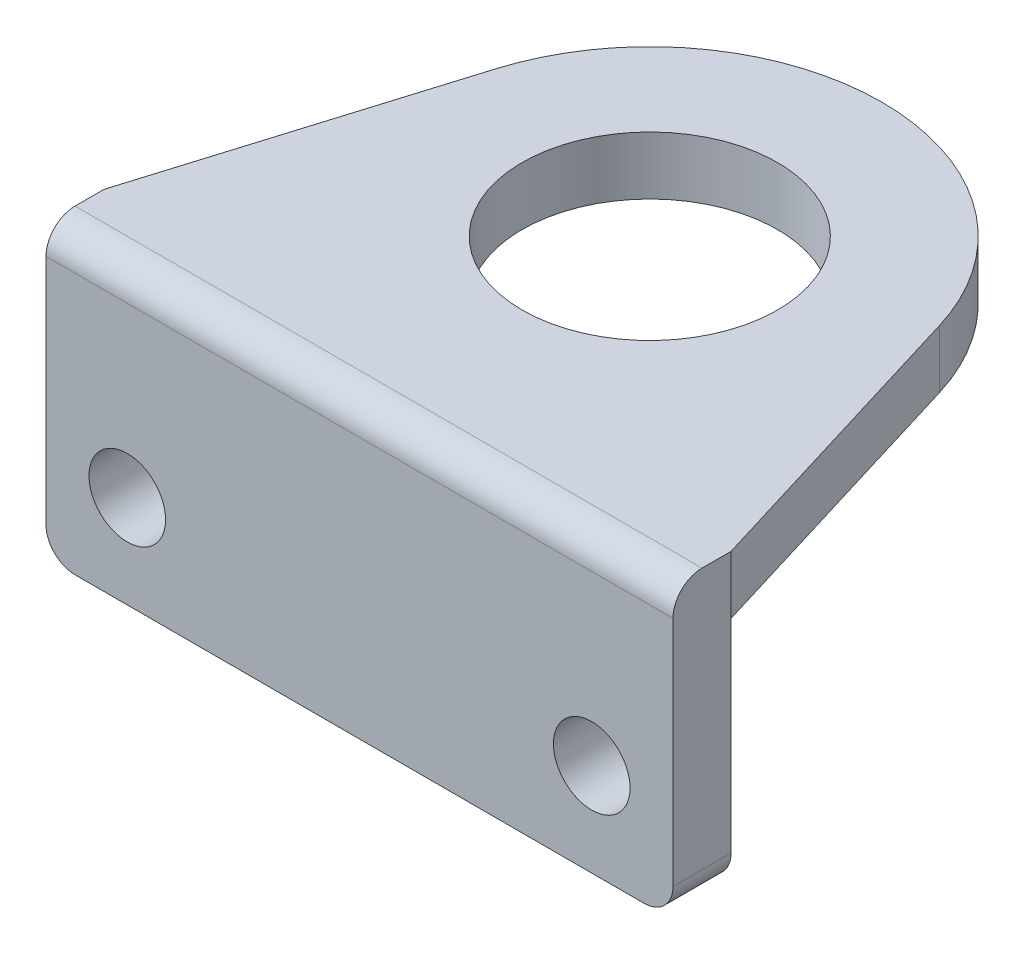
from build123d import *

# Parameters (mm, degrees)
CROQUIS1_R              = 11
SALIENTE_EXTRUIR1_DEPTH = 5
CROQUIS2_W              = 54
CROQUIS2_H              = 25
CROQUIS2_R              = 3.3
SALIENTE_EXTRUIR2_DEPTH = 5
REDONDEO1_R             = 2.5
REDONDEO2_R             = 2.5


with BuildPart() as part:
    # Croquis1 → Saliente-Extruir1 (new body)
    with BuildSketch(Plane(origin=(0, 0, 0), x_dir=(1, 0, 0), z_dir=(0, 1, 0))):
        with BuildLine():
            Line((-27, 0), (27, 0))
            Line((27, 0), (27, 5))
            Line((27, 5), (19.131975199, 30.828166519))
            ThreePointArc((19.131975199, 30.828166519), (0, 45), (-19.131975199, 30.828166519))
            Line((-19.131975199, 30.828166519), (-27, 5))
            Line((-27, 5), (-27, 0))
        make_face()
        with Locations(Location((0, 25, 0), (0, 0, 270))):
            Circle(CROQUIS1_R, mode=Mode.SUBTRACT)
    extrude(amount=-SALIENTE_EXTRUIR1_DEPTH)

    # Croquis2 → Saliente-Extruir2 (add)
    with BuildSketch(Plane.XY):
        with Locations((0, -12.5)):
            Rectangle(CROQUIS2_W, CROQUIS2_H)
        with Locations((20, -17)):
            Circle(CROQUIS2_R, mode=Mode.SUBTRACT)
        with Locations((-20, -17)):
            Circle(CROQUIS2_R, mode=Mode.SUBTRACT)
    extrude(amount=-SALIENTE_EXTRUIR2_DEPTH)

    # Redondeo1
    redondeo1_edges = [part.edges().sort_by_distance(p)[0] for p in [
        (0, 0, 0),
    ]]
    fillet(redondeo1_edges, radius=REDONDEO1_R)

    # Redondeo2
    redondeo2_edges = [part.edges().sort_by_distance(p)[0] for p in [
        (-27, -25, -2.5),
        (27, -25, -2.5),
    ]]
    fillet(redondeo2_edges, radius=REDONDEO2_R)


solid = part.part
